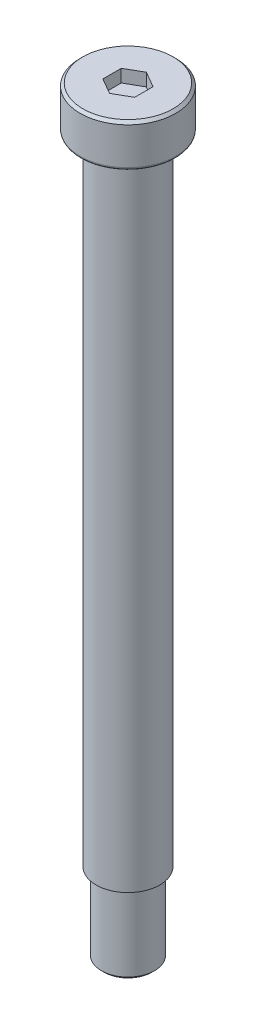
from build123d import *

# Parameters (mm, degrees)
CUT_EXTRUDE1_DEPTH = 2.4
CHAMFER1_SIZE      = 0.5
FILLET1_R          = 0.5
CHAMFER2_SIZE      = 0.5


with BuildPart() as part:
    # Sketch1 → Revolve1 (revolve)
    with BuildSketch(Plane.XY, mode=Mode.PRIVATE) as revolve1_sk:
        Polygon((0, 0), (9, 0), (9, -8), (5.75, -8), (5.75, -8.5), (6, -8.5), (6, -128), (5, -128), (5, -143), (0, -143), align=None)
    revolve(revolve1_sk.sketch.rotate(Axis((0, 5, 0), (0, -1, 0)), 180), axis=Axis((0, 5, 0), (0, -1, 0)))

    # Sketch2 → Cut-Extrude1 (cut)
    with BuildSketch(Plane(origin=(0, 0, 0), x_dir=(1, 0, 0), z_dir=(0, 1, 0))):
        Polygon((0, -3.464101615), (3, -1.732050808), (3, 1.732050808), (0, 3.464101615), (-3, 1.732050808), (-3, -1.732050808), align=None)
    extrude(amount=-CUT_EXTRUDE1_DEPTH, mode=Mode.SUBTRACT)

    # Chamfer1
    chamfer1_edges = [part.edges().sort_by_distance(p)[0] for p in [
        (9, 0, 0),
    ]]
    chamfer(chamfer1_edges, length=CHAMFER1_SIZE)

    # Fillet1
    fillet1_edges = [part.edges().sort_by_distance(p)[0] for p in [
        (9, -8, 0),
    ]]
    fillet(fillet1_edges, radius=FILLET1_R)

    # Chamfer2
    chamfer2_edges = [part.edges().sort_by_distance(p)[0] for p in [
        (5, -143, 0),
    ]]
    chamfer(chamfer2_edges, length=CHAMFER2_SIZE)


solid = part.part
